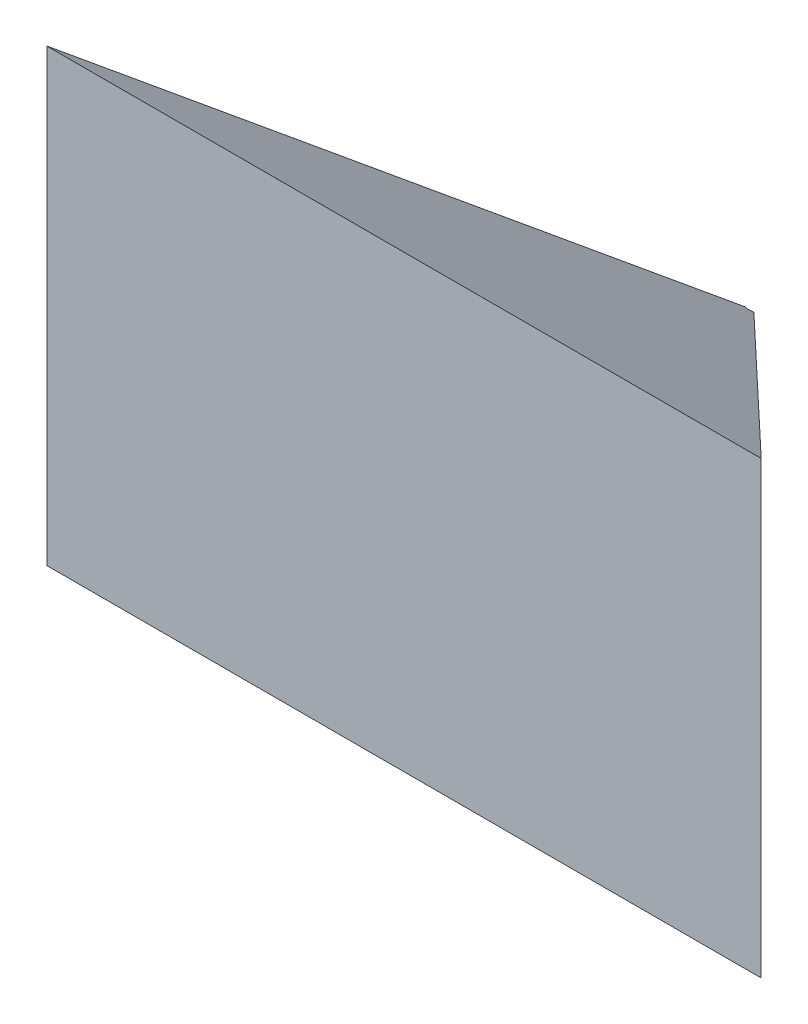
from build123d import *

# Parameters (mm, degrees)
SKETCH1_W               = 12.8
SKETCH1_H               = 7.2
BOSS_EXTRUDE1_DEPTH     = 10000
BOSS_EXTRUDE1_TAPER     = -45.6
CUT_EXTRUDE1_DEPTH      = 17579.213488948
CUT_EXTRUDE1_DEPTH_BACK = 17579.213488948


with BuildPart() as part:
    # Sketch1 → Boss-Extrude1 (new body)
    with BuildSketch(Plane.XY.offset(-0.1)):
        with Locations((-11.5, 0)):
            Rectangle(SKETCH1_W, SKETCH1_H)
    extrude(amount=BOSS_EXTRUDE1_DEPTH, taper=BOSS_EXTRUDE1_TAPER)

    # Sketch2 → Cut-Extrude1 (cut, two sides: drawn at the far end of the back side and taken through both)
    with BuildSketch(Plane(origin=(0, 0, 0), x_dir=(0, -1, 0), z_dir=(1, 0, 0)).offset(-CUT_EXTRUDE1_DEPTH_BACK)):
        Polygon((-12631.780949959, -19632.606169723), (-3.6, 0.1), (3.6, 0.1), (12631.780949959, -19632.606169723), (22327.50273382, 5804.710423836), (-20603.431761532, 5804.710423836), align=None)
    extrude(amount=CUT_EXTRUDE1_DEPTH + CUT_EXTRUDE1_DEPTH_BACK, mode=Mode.SUBTRACT)

    # Sketch4 → Cut-Revolve3 (revolve, cut)
    with BuildSketch(Plane(origin=(0, 0, 0), x_dir=(0, 0, -1), z_dir=(1, 0, 0))):
        with BuildLine():
            Line((0, -200), (0, 200))
            ThreePointArc((0, 200), (-200, 0), (0, -200))
        make_face()
    revolve(axis=Axis((0, 3540.008208747, 0), (0, -1, 0)), mode=Mode.SUBTRACT)


solid = part.part
